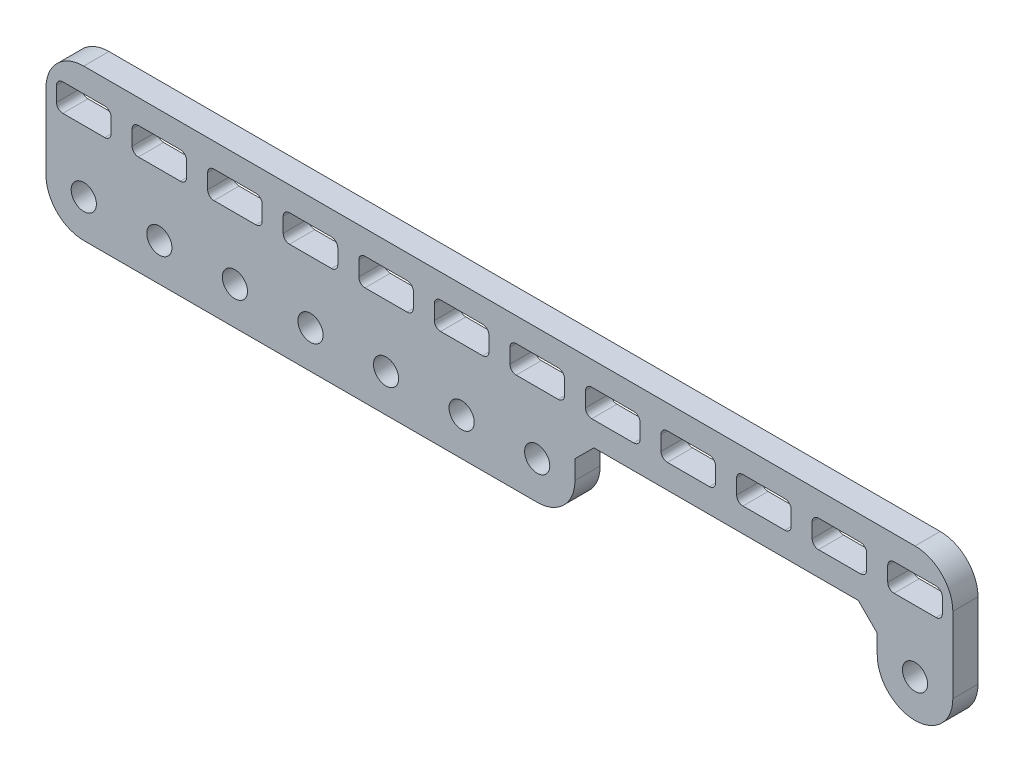
from build123d import *

# Parameters (mm, degrees)
MODEL_R                 = 1.5
SALIENTE_EXTRUIR1_DEPTH = 3


with BuildPart() as part:
    # Model → Saliente-Extruir1 (new body)
    with BuildSketch(Plane.XY):
        with BuildLine():
            Line((256.429131311, 228.742243614), (355.429131311, 228.742243614))
            ThreePointArc((355.429131311, 228.742243614), (358.611111826, 227.424224129), (359.929131311, 224.242243614))
            Line((359.929131311, 224.242243614), (359.929131311, 215.242243614))
            ThreePointArc((359.929131311, 215.242243614), (355.429131311, 210.742243614), (350.929131311, 215.242243614))
            Line((350.929131311, 215.242243614), (350.929131311, 217.492243614))
            Line((350.929131311, 217.492243614), (348.679131311, 219.742243614))
            Line((348.679131311, 219.742243614), (317.179131311, 219.742243614))
            Line((317.179131311, 219.742243614), (314.929131311, 217.492243614))
            Line((314.929131311, 217.492243614), (314.929131311, 215.242243614))
            ThreePointArc((314.929131311, 215.242243614), (313.611111826, 212.060263099), (310.429131311, 210.742243614))
            Line((310.429131311, 210.742243614), (256.429131311, 210.742243614))
            ThreePointArc((256.429131311, 210.742243614), (253.247150795, 212.060263099), (251.929131311, 215.242243614))
            Line((251.929131311, 215.242243614), (251.929131311, 224.242243614))
            ThreePointArc((251.929131311, 224.242243614), (253.247150795, 227.424224129), (256.429131311, 228.742243614))
        make_face()
        with Locations((310.429131311, 215.242243614)):
            Circle(MODEL_R, mode=Mode.SUBTRACT)
        with Locations((292.429131311, 215.242243614)):
            Circle(MODEL_R, mode=Mode.SUBTRACT)
        with Locations((301.429131311, 215.242243614)):
            Circle(MODEL_R, mode=Mode.SUBTRACT)
        with Locations((274.429131311, 215.242243614)):
            Circle(MODEL_R, mode=Mode.SUBTRACT)
        with Locations((283.429131311, 215.242243614)):
            Circle(MODEL_R, mode=Mode.SUBTRACT)
        with Locations((265.429131311, 215.242243614)):
            Circle(MODEL_R, mode=Mode.SUBTRACT)
        with Locations((256.429131311, 215.242243614)):
            Circle(MODEL_R, mode=Mode.SUBTRACT)
        with Locations((355.429131311, 215.242243614)):
            Circle(MODEL_R, mode=Mode.SUBTRACT)
        with BuildLine():
            Line((267.929131311, 222.617243614), (262.929131311, 222.617243614))
            ThreePointArc((262.929131311, 222.617243614), (262.398801225, 222.836913528), (262.179131311, 223.367243614))
            Line((262.179131311, 223.367243614), (262.179131311, 225.117243614))
            ThreePointArc((262.179131311, 225.117243614), (262.398801225, 225.6475737), (262.929131311, 225.867243614))
            Line((262.929131311, 225.867243614), (267.929131311, 225.867243614))
            ThreePointArc((267.929131311, 225.867243614), (268.459461397, 225.6475737), (268.679131311, 225.117243614))
            Line((268.679131311, 225.117243614), (268.679131311, 223.367243614))
            ThreePointArc((268.679131311, 223.367243614), (268.459461397, 222.836913528), (267.929131311, 222.617243614))
        make_face(mode=Mode.SUBTRACT)
        with BuildLine():
            Line((285.929131311, 222.617243614), (280.929131311, 222.617243614))
            ThreePointArc((280.929131311, 222.617243614), (280.398801225, 222.836913528), (280.179131311, 223.367243614))
            Line((280.179131311, 223.367243614), (280.179131311, 225.117243614))
            ThreePointArc((280.179131311, 225.117243614), (280.398801225, 225.6475737), (280.929131311, 225.867243614))
            Line((280.929131311, 225.867243614), (285.929131311, 225.867243614))
            ThreePointArc((285.929131311, 225.867243614), (286.459461397, 225.6475737), (286.679131311, 225.117243614))
            Line((286.679131311, 225.117243614), (286.679131311, 223.367243614))
            ThreePointArc((286.679131311, 223.367243614), (286.459461397, 222.836913528), (285.929131311, 222.617243614))
        make_face(mode=Mode.SUBTRACT)
        with BuildLine():
            Line((258.929131311, 222.617243614), (253.929131311, 222.617243614))
            ThreePointArc((253.929131311, 222.617243614), (253.398801225, 222.836913528), (253.179131311, 223.367243614))
            Line((253.179131311, 223.367243614), (253.179131311, 225.117243614))
            ThreePointArc((253.179131311, 225.117243614), (253.398801225, 225.6475737), (253.929131311, 225.867243614))
            Line((253.929131311, 225.867243614), (258.929131311, 225.867243614))
            ThreePointArc((258.929131311, 225.867243614), (259.459461397, 225.6475737), (259.679131311, 225.117243614))
            Line((259.679131311, 225.117243614), (259.679131311, 223.367243614))
            ThreePointArc((259.679131311, 223.367243614), (259.459461397, 222.836913528), (258.929131311, 222.617243614))
        make_face(mode=Mode.SUBTRACT)
        with BuildLine():
            Line((276.929131311, 222.617243614), (271.929131311, 222.617243614))
            ThreePointArc((271.929131311, 222.617243614), (271.398801225, 222.836913528), (271.179131311, 223.367243614))
            Line((271.179131311, 223.367243614), (271.179131311, 225.117243614))
            ThreePointArc((271.179131311, 225.117243614), (271.398801225, 225.6475737), (271.929131311, 225.867243614))
            Line((271.929131311, 225.867243614), (276.929131311, 225.867243614))
            ThreePointArc((276.929131311, 225.867243614), (277.459461397, 225.6475737), (277.679131311, 225.117243614))
            Line((277.679131311, 225.117243614), (277.679131311, 223.367243614))
            ThreePointArc((277.679131311, 223.367243614), (277.459461397, 222.836913528), (276.929131311, 222.617243614))
        make_face(mode=Mode.SUBTRACT)
        with BuildLine():
            Line((294.929131311, 222.617243614), (289.929131311, 222.617243614))
            ThreePointArc((289.929131311, 222.617243614), (289.398801225, 222.836913528), (289.179131311, 223.367243614))
            Line((289.179131311, 223.367243614), (289.179131311, 225.117243614))
            ThreePointArc((289.179131311, 225.117243614), (289.398801225, 225.6475737), (289.929131311, 225.867243614))
            Line((289.929131311, 225.867243614), (294.929131311, 225.867243614))
            ThreePointArc((294.929131311, 225.867243614), (295.459461397, 225.6475737), (295.679131311, 225.117243614))
            Line((295.679131311, 225.117243614), (295.679131311, 223.367243614))
            ThreePointArc((295.679131311, 223.367243614), (295.459461397, 222.836913528), (294.929131311, 222.617243614))
        make_face(mode=Mode.SUBTRACT)
        with BuildLine():
            Line((303.929131311, 222.617243614), (298.929131311, 222.617243614))
            ThreePointArc((298.929131311, 222.617243614), (298.398801225, 222.836913528), (298.179131311, 223.367243614))
            Line((298.179131311, 223.367243614), (298.179131311, 225.117243614))
            ThreePointArc((298.179131311, 225.117243614), (298.398801225, 225.6475737), (298.929131311, 225.867243614))
            Line((298.929131311, 225.867243614), (303.929131311, 225.867243614))
            ThreePointArc((303.929131311, 225.867243614), (304.459461397, 225.6475737), (304.679131311, 225.117243614))
            Line((304.679131311, 225.117243614), (304.679131311, 223.367243614))
            ThreePointArc((304.679131311, 223.367243614), (304.459461397, 222.836913528), (303.929131311, 222.617243614))
        make_face(mode=Mode.SUBTRACT)
        with BuildLine():
            Line((321.929131311, 222.617243614), (316.929131311, 222.617243614))
            ThreePointArc((316.929131311, 222.617243614), (316.398801225, 222.836913528), (316.179131311, 223.367243614))
            Line((316.179131311, 223.367243614), (316.179131311, 225.117243614))
            ThreePointArc((316.179131311, 225.117243614), (316.398801225, 225.6475737), (316.929131311, 225.867243614))
            Line((316.929131311, 225.867243614), (321.929131311, 225.867243614))
            ThreePointArc((321.929131311, 225.867243614), (322.459461397, 225.6475737), (322.679131311, 225.117243614))
            Line((322.679131311, 225.117243614), (322.679131311, 223.367243614))
            ThreePointArc((322.679131311, 223.367243614), (322.459461397, 222.836913528), (321.929131311, 222.617243614))
        make_face(mode=Mode.SUBTRACT)
        with BuildLine():
            Line((312.929131311, 222.617243614), (307.929131311, 222.617243614))
            ThreePointArc((307.929131311, 222.617243614), (307.398801225, 222.836913528), (307.179131311, 223.367243614))
            Line((307.179131311, 223.367243614), (307.179131311, 225.117243614))
            ThreePointArc((307.179131311, 225.117243614), (307.398801225, 225.6475737), (307.929131311, 225.867243614))
            Line((307.929131311, 225.867243614), (312.929131311, 225.867243614))
            ThreePointArc((312.929131311, 225.867243614), (313.459461397, 225.6475737), (313.679131311, 225.117243614))
            Line((313.679131311, 225.117243614), (313.679131311, 223.367243614))
            ThreePointArc((313.679131311, 223.367243614), (313.459461397, 222.836913528), (312.929131311, 222.617243614))
        make_face(mode=Mode.SUBTRACT)
        with BuildLine():
            Line((357.929131311, 222.617243614), (352.929131311, 222.617243614))
            ThreePointArc((352.929131311, 222.617243614), (352.398801225, 222.836913528), (352.179131311, 223.367243614))
            Line((352.179131311, 223.367243614), (352.179131311, 225.117243614))
            ThreePointArc((352.179131311, 225.117243614), (352.398801225, 225.6475737), (352.929131311, 225.867243614))
            Line((352.929131311, 225.867243614), (357.929131311, 225.867243614))
            ThreePointArc((357.929131311, 225.867243614), (358.459461397, 225.6475737), (358.679131311, 225.117243614))
            Line((358.679131311, 225.117243614), (358.679131311, 223.367243614))
            ThreePointArc((358.679131311, 223.367243614), (358.459461397, 222.836913528), (357.929131311, 222.617243614))
        make_face(mode=Mode.SUBTRACT)
        with BuildLine():
            Line((348.929131311, 222.617243614), (343.929131311, 222.617243614))
            ThreePointArc((343.929131311, 222.617243614), (343.398801225, 222.836913528), (343.179131311, 223.367243614))
            Line((343.179131311, 223.367243614), (343.179131311, 225.117243614))
            ThreePointArc((343.179131311, 225.117243614), (343.398801225, 225.6475737), (343.929131311, 225.867243614))
            Line((343.929131311, 225.867243614), (348.929131311, 225.867243614))
            ThreePointArc((348.929131311, 225.867243614), (349.459461397, 225.6475737), (349.679131311, 225.117243614))
            Line((349.679131311, 225.117243614), (349.679131311, 223.367243614))
            ThreePointArc((349.679131311, 223.367243614), (349.459461397, 222.836913528), (348.929131311, 222.617243614))
        make_face(mode=Mode.SUBTRACT)
        with BuildLine():
            Line((339.929131311, 222.617243614), (334.929131311, 222.617243614))
            ThreePointArc((334.929131311, 222.617243614), (334.398801225, 222.836913528), (334.179131311, 223.367243614))
            Line((334.179131311, 223.367243614), (334.179131311, 225.117243614))
            ThreePointArc((334.179131311, 225.117243614), (334.398801225, 225.6475737), (334.929131311, 225.867243614))
            Line((334.929131311, 225.867243614), (339.929131311, 225.867243614))
            ThreePointArc((339.929131311, 225.867243614), (340.459461397, 225.6475737), (340.679131311, 225.117243614))
            Line((340.679131311, 225.117243614), (340.679131311, 223.367243614))
            ThreePointArc((340.679131311, 223.367243614), (340.459461397, 222.836913528), (339.929131311, 222.617243614))
        make_face(mode=Mode.SUBTRACT)
        with BuildLine():
            Line((330.929131311, 222.617243614), (325.929131311, 222.617243614))
            ThreePointArc((325.929131311, 222.617243614), (325.398801225, 222.836913528), (325.179131311, 223.367243614))
            Line((325.179131311, 223.367243614), (325.179131311, 225.117243614))
            ThreePointArc((325.179131311, 225.117243614), (325.398801225, 225.6475737), (325.929131311, 225.867243614))
            Line((325.929131311, 225.867243614), (330.929131311, 225.867243614))
            ThreePointArc((330.929131311, 225.867243614), (331.459461397, 225.6475737), (331.679131311, 225.117243614))
            Line((331.679131311, 225.117243614), (331.679131311, 223.367243614))
            ThreePointArc((331.679131311, 223.367243614), (331.459461397, 222.836913528), (330.929131311, 222.617243614))
        make_face(mode=Mode.SUBTRACT)
    extrude(amount=SALIENTE_EXTRUIR1_DEPTH)


solid = part.part
